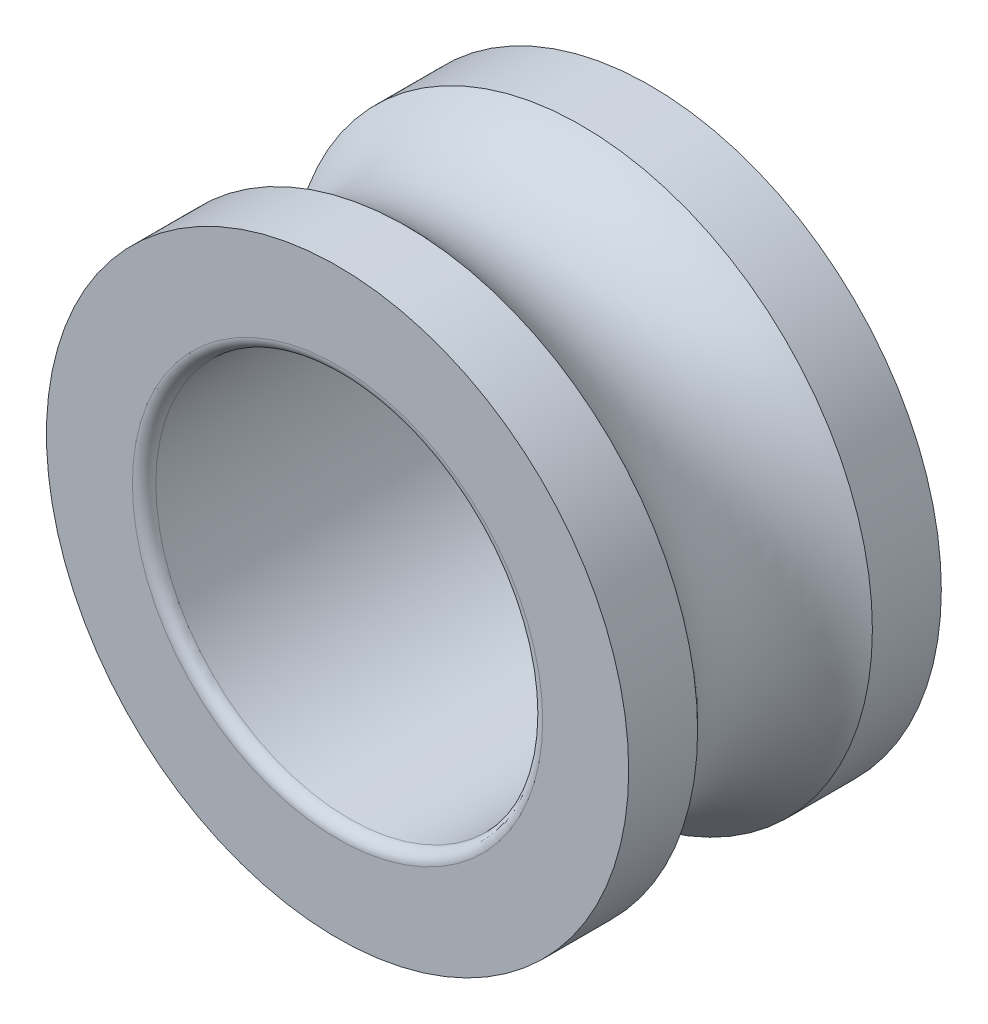
from build123d import *


with BuildPart() as part:
    # Sketch1 → Revolve1 (revolve)
    with BuildSketch(Plane(origin=(0, 0, 0), x_dir=(0, 0, -1), z_dir=(1, 0, 0)), mode=Mode.PRIVATE) as revolve1_sk:
        with BuildLine():
            Line((-4, 7.45), (-2.236067977, 7.45))
            ThreePointArc((-2.236067977, 7.45), (0, 6.45), (2.236067977, 7.45))
            Line((2.236067977, 7.45), (4, 7.45))
            Line((4, 7.45), (4, 5.25))
            ThreePointArc((4, 5.25), (3.912132034, 5.037867966), (3.7, 4.95))
            Line((3.7, 4.95), (-3.7, 4.95))
            ThreePointArc((-3.7, 4.95), (-3.912132034, 5.037867966), (-4, 5.25))
            Line((-4, 5.25), (-4, 7.45))
        make_face()
    revolve(revolve1_sk.sketch.rotate(Axis((0, 0, 7.419354839), (0, 0, -1)), 90), axis=Axis((0, 0, 7.419354839), (0, 0, -1)))


solid = part.part
